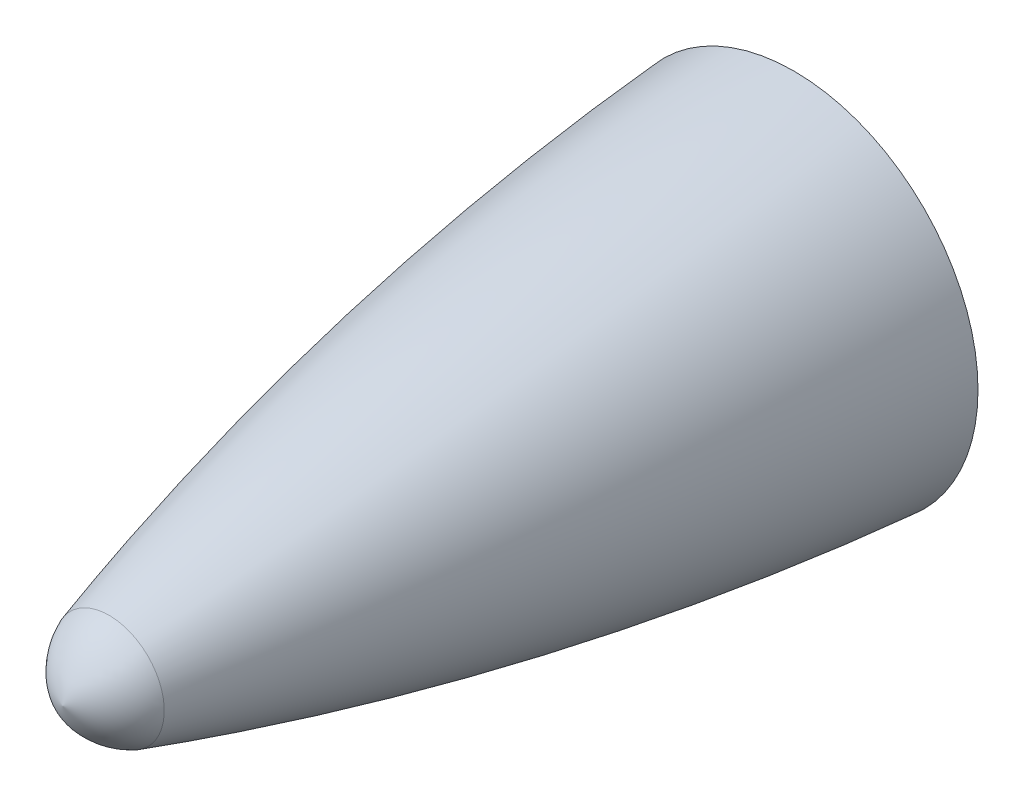
from build123d import *


with BuildPart() as part:
    # Sketch2 → Revolve1 (revolve)
    with BuildSketch(Plane(origin=(0, 0, 0), x_dir=(0, 0, -1), z_dir=(1, 0, 0)), mode=Mode.PRIVATE) as revolve1_sk:
        with BuildLine():
            Line((-12, 0), (-35.841139357, 0))
            ThreePointArc((-35.841139357, 0), (-35.294277123, 1.078160146), (-34.322423622, 1.797179182))
            ThreePointArc((-34.322423622, 1.797179182), (-23.276329769, 4.510015091), (-12, 6))
            Line((-12, 6), (-12, 0))
        make_face()
    revolve(revolve1_sk.sketch.rotate(Axis((0, 0, 12), (0, 0, 1)), 90), axis=Axis((0, 0, 12), (0, 0, 1)))


solid = part.part
